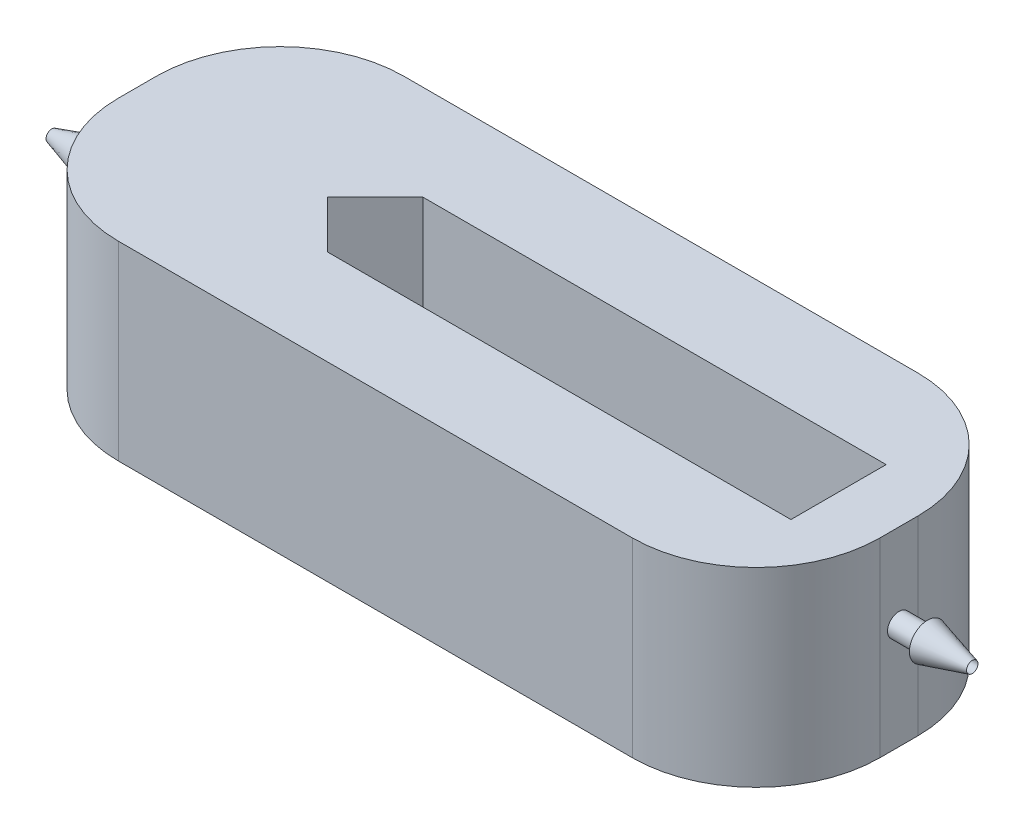
from build123d import *

# Parameters (mm, degrees)
SKETCH1_W               = 80
SKETCH1_H               = 30
BOSS_EXTRUDE1_DEPTH     = 60
CUT_EXTRUDE1_DEPTH      = 75
CUT_EXTRUDE2_DEPTH      = 102.118742081
CUT_EXTRUDE2_DEPTH_BACK = 102.118742081
SKETCH3_R               = 0.8
SKETCH4_R               = 1.5
SKETCH4_R_2             = 1.2
BOSS_EXTRUDE2_DEPTH     = 3
SKETCH7_R               = 0.6
CUT_EXTRUDE3_DEPTH      = 2
SKETCH8_R               = 0.8
CUT_EXTRUDE4_DEPTH      = 53
FILLET1_R               = 13
SKETCH9_R               = 1.2
SKETCH9_R_2             = 0.8
BOSS_EXTRUDE3_DEPTH     = 3
CUT_EXTRUDE5_START      = -2
SKETCH12_R              = 0.6
CUT_EXTRUDE5_DEPTH      = 2
CUT_EXTRUDE6_START      = -35
SKETCH14_R              = 0.8
CUT_EXTRUDE6_DEPTH      = 35
SKETCH15_W              = 83.696095513
SKETCH15_H              = 31.69844841
CUT_EXTRUDE7_DEPTH      = 50


with BuildPart() as part:
    # Sketch1 → Boss-Extrude1 (new body)
    with BuildSketch(Plane(origin=(0, 0, 0), x_dir=(1, 0, 0), z_dir=(0, 1, 0))):
        Rectangle(SKETCH1_W, SKETCH1_H)
    extrude(amount=BOSS_EXTRUDE1_DEPTH)

    # Sketch2 → Cut-Extrude1 (cut)
    with BuildSketch(Plane(origin=(0, 60, 0), x_dir=(1, 0, 0), z_dir=(0, 1, 0))):
        Polygon((-15, 5), (15, 5), (33.657016573, 5), (33.657016573, -5), (15, -5), (-15, -5), (-20, 0), align=None)
    extrude(amount=-CUT_EXTRUDE1_DEPTH, mode=Mode.SUBTRACT)

    # Sketch3 → Cut-Extrude2 (cut, two sides: drawn at the far end of the back side and taken through both)
    with BuildSketch(Plane.ZY.offset(40).offset(-CUT_EXTRUDE2_DEPTH_BACK)):
        with Locations(Location((0, 51.111959895, 0), (0, 0, 270))):
            Circle(SKETCH3_R)
    extrude(amount=CUT_EXTRUDE2_DEPTH + CUT_EXTRUDE2_DEPTH_BACK, mode=Mode.SUBTRACT)

    # Sketch4 → Boss-Extrude2 (add)
    with BuildSketch(Plane.ZY.offset(40)):
        with Locations(Location((0, 51.111959895, 0), (0, 0, 180))):
            Circle(SKETCH4_R)
        with Locations((0, 51.111959895)):
            Circle(SKETCH4_R_2, mode=Mode.SUBTRACT)
    extrude(amount=BOSS_EXTRUDE2_DEPTH)

    # Sketch6 → Revolve1 (revolve)
    with BuildSketch(Plane.XY, mode=Mode.PRIVATE) as revolve1_sk:
        Polygon((-43, 51.111959895), (-49.325220868, 51.111959895), (-49.325220868, 51.611959895), (-43, 53.511959895), align=None)
    revolve(revolve1_sk.sketch.rotate(Axis((-43, 51.111959895, 0), (-1, 0, 0)), 270), axis=Axis((-43, 51.111959895, 0), (-1, 0, 0)))

    # Sketch7 → Cut-Extrude3 (cut)
    with BuildSketch(Plane.ZY.offset(49.325220868)):
        with Locations((0, 51.111959895)):
            Circle(SKETCH7_R)
    extrude(amount=-CUT_EXTRUDE3_DEPTH, mode=Mode.SUBTRACT)

    # Sketch8 → Cut-Extrude4 (cut)
    with BuildSketch(Plane.ZY.offset(47.325220868)):
        with Locations(Location((0, 51.111959895, 0), (0, 0, 270))):
            Circle(SKETCH8_R)
    extrude(amount=-CUT_EXTRUDE4_DEPTH, mode=Mode.SUBTRACT)

    # Fillet1
    fillet1_edges = [part.edges().sort_by_distance(p)[0] for p in [
        (40, 30, 15),
        (-40, 30, 15),
        (-40, 30, -15),
        (40, 30, -15),
    ]]
    fillet(fillet1_edges, radius=FILLET1_R)

    # Sketch9 → Boss-Extrude3 (add)
    with BuildSketch(Plane(origin=(40, 0, 0), x_dir=(0, 0, -1), z_dir=(1, 0, 0))):
        with Locations(Location((0, 51.111959895, 0), (0, 0, 180))):
            Circle(SKETCH9_R)
        with Locations(Location((0, 51.111959895, 0), (0, 0, 270))):
            Circle(SKETCH9_R_2, mode=Mode.SUBTRACT)
    extrude(amount=BOSS_EXTRUDE3_DEPTH)

    # Sketch15 → Cut-Extrude7 (cut)
    with BuildSketch(Plane(origin=(0, -10, 0), x_dir=(-1, 0, 0), z_dir=(0, -1, 0))):
        with Locations((-0.057440767, 0.030479277)):
            Rectangle(SKETCH15_W, SKETCH15_H)
    extrude(amount=-CUT_EXTRUDE7_DEPTH, mode=Mode.SUBTRACT)


with BuildPart() as body_2:
    # Sketch11 → Revolve2 (revolve)
    with BuildSketch(Plane.XY, mode=Mode.PRIVATE) as revolve2_sk:
        Polygon((43, 51.111959895), (43, 53.013316413), (47.705149283, 51.711959895), (47.705149283, 51.111959895), align=None)
    revolve(revolve2_sk.sketch.rotate(Axis((43, 51.111959895, 0), (1, 0, 0)), 270), axis=Axis((43, 51.111959895, 0), (1, 0, 0)))

    # Sketch12 → Cut-Extrude5 (cut)
    with BuildSketch(Plane(origin=(47.705149283, 0, 0), x_dir=(0, 0, -1), z_dir=(1, 0, 0)).offset(CUT_EXTRUDE5_START)):
        with Locations((0, 51.111959895)):
            Circle(SKETCH12_R)
    extrude(amount=CUT_EXTRUDE5_DEPTH, mode=Mode.SUBTRACT)

    # Sketch14 → Cut-Extrude6 (cut)
    with BuildSketch(Plane(origin=(45.705149283, 0, 0), x_dir=(0, 0, -1), z_dir=(1, 0, 0)).offset(CUT_EXTRUDE6_START)):
        with Locations((0, 51.111959895)):
            Circle(SKETCH14_R)
    extrude(amount=CUT_EXTRUDE6_DEPTH, mode=Mode.SUBTRACT)


solid = Compound([part.part, body_2.part])
